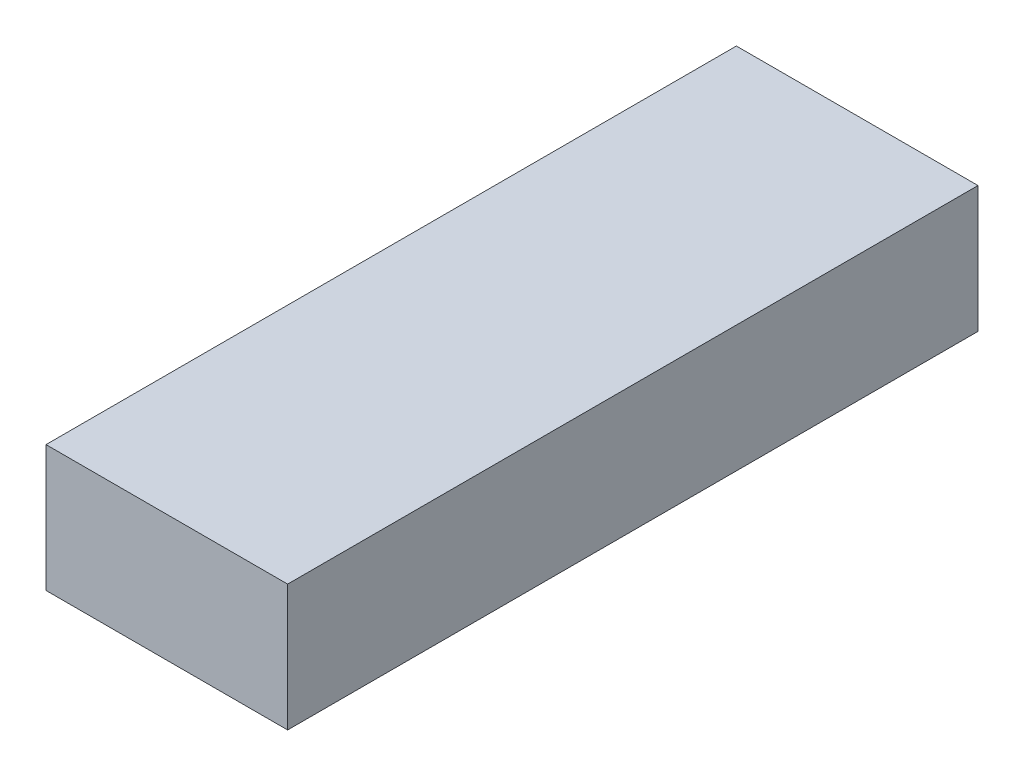
from build123d import *

# Parameters (mm, degrees)
SKETCH1_W           = 8.89
SKETCH1_H           = 4.6482
BOSS_EXTRUDE1_DEPTH = 25.4


with BuildPart() as part:
    # Sketch1 → Boss-Extrude1 (new body)
    with BuildSketch(Plane.XY):
        with Locations((4.445, 2.3241)):
            Rectangle(SKETCH1_W, SKETCH1_H)
    extrude(amount=BOSS_EXTRUDE1_DEPTH)


solid = part.part
